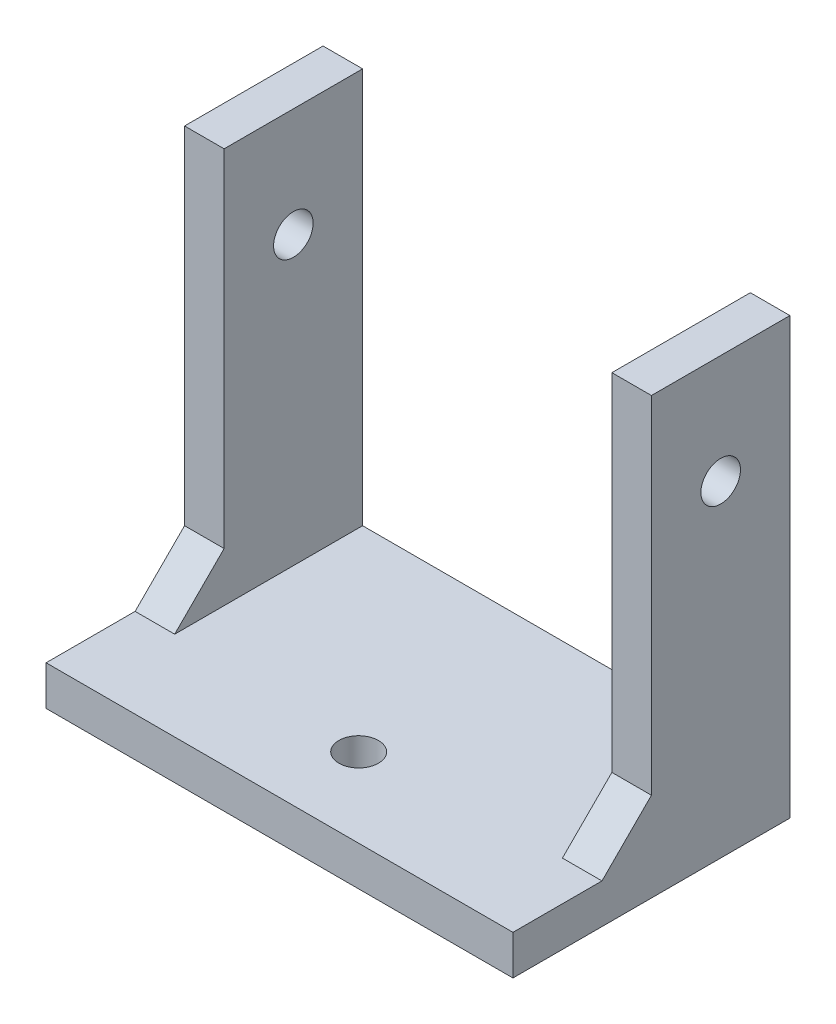
from build123d import *

# Parameters (mm, degrees)
SKETCH1_W           = 23.6
SKETCH1_H           = 14
BOSS_EXTRUDE1_DEPTH = 2
BOSS_EXTRUDE2_DEPTH = 2
BOSS_EXTRUDE3_DEPTH = 2
SKETCH4_R           = 1
CUT_EXTRUDE1_DEPTH  = 2
SKETCH5_R           = 1
CUT_EXTRUDE2_DEPTH  = 34.01454225


with BuildPart() as part:
    # Sketch1 → Boss-Extrude1 (new body)
    with BuildSketch(Plane(origin=(0, 0, 0), x_dir=(1, 0, 0), z_dir=(0, 1, 0))):
        Rectangle(SKETCH1_W, SKETCH1_H)
    extrude(amount=BOSS_EXTRUDE1_DEPTH)

    # Sketch2 → Boss-Extrude2 (add)
    with BuildSketch(Plane(origin=(11.8, 0, 0), x_dir=(0, 0, -1), z_dir=(1, 0, 0))):
        Polygon((7, 2), (0, 2), (-2.5, 2), (0, 4.5), (0, 22), (7, 22), align=None)
    extrude(amount=-BOSS_EXTRUDE2_DEPTH)

    # Sketch3 → Boss-Extrude3 (add)
    with BuildSketch(Plane.ZY.offset(11.8)):
        Polygon((-7, 22), (-7, 2), (2.5, 2), (0, 4.5), (0, 22), align=None)
    extrude(amount=-BOSS_EXTRUDE3_DEPTH)

    # Sketch4 → Cut-Extrude1 (cut)
    with BuildSketch(Plane.XZ):
        with Locations(Location((0, 3, 0), (0, 0, 270))):
            Circle(SKETCH4_R)
    extrude(amount=-CUT_EXTRUDE1_DEPTH, mode=Mode.SUBTRACT)

    # Sketch5 → Cut-Extrude2 (cut, through all)
    with BuildSketch(Plane(origin=(11.8, 0, 0), x_dir=(0, 0, -1), z_dir=(1, 0, 0))):
        with Locations((3.5, 16.5)):
            Circle(SKETCH5_R)
    extrude(amount=-CUT_EXTRUDE2_DEPTH, mode=Mode.SUBTRACT)


solid = part.part
